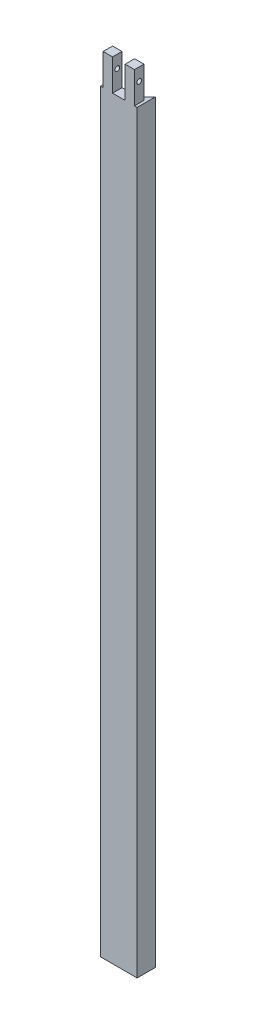
from build123d import *

# Parameters (mm, degrees)
SKETCH2_W           = 6
SKETCH2_H           = 240
BOSS_EXTRUDE1_DEPTH = 3
BOSS_EXTRUDE2_DEPTH = 240
SKETCH5_W           = 3
SKETCH5_H           = 3
BOSS_EXTRUDE3_DEPTH = 10
SKETCH6_R           = 0.75
CUT_EXTRUDE1_DEPTH  = 40


with BuildPart() as part:
    # Sketch2 → Boss-Extrude1 (new body)
    with BuildSketch(Plane.XY):
        with Locations((-3, -120)):
            Rectangle(SKETCH2_W, SKETCH2_H)
    extrude(amount=BOSS_EXTRUDE1_DEPTH)

    # Sketch4 → Boss-Extrude2 (add)
    with BuildSketch(Plane(origin=(0, -240, 0), x_dir=(-1, 0, 0), z_dir=(0, -1, 0))):
        Polygon((0, 0), (-2.828427125, 2.828427125), (-2.828427125, -3), (0, -3), align=None)
        Polygon((8.828427125, -3), (6, -3), (6, 0), (8.828427125, 2.828427125), align=None)
    extrude(amount=-BOSS_EXTRUDE2_DEPTH)

    # Sketch5 → Boss-Extrude3 (add)
    with BuildSketch(Plane(origin=(0, 0, 0), x_dir=(1, 0, 0), z_dir=(0, 1, 0))):
        with Locations((-6.5, -1.5)):
            Rectangle(SKETCH5_W, SKETCH5_H)
        with Locations((0.5, -1.5)):
            Rectangle(SKETCH5_W, SKETCH5_H)
    extrude(amount=BOSS_EXTRUDE3_DEPTH)

    # Sketch6 → Cut-Extrude1 (cut)
    with BuildSketch(Plane(origin=(2, 0, 0), x_dir=(0, 0, -1), z_dir=(1, 0, 0))):
        with Locations((-1.5, 6)):
            Circle(SKETCH6_R)
    extrude(amount=-CUT_EXTRUDE1_DEPTH, mode=Mode.SUBTRACT)


solid = part.part
